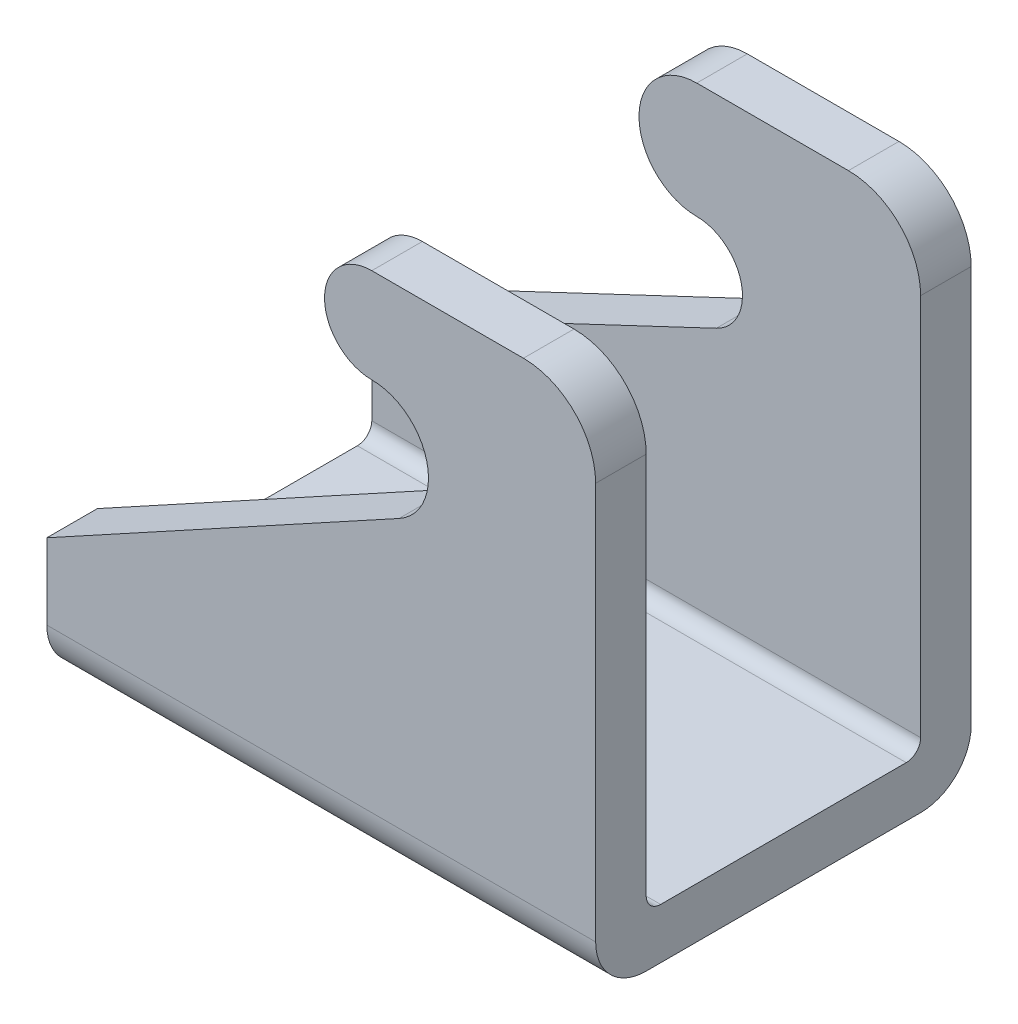
from build123d import *

# Parameters (mm, degrees)
SKETCH1_W           = 38
SKETCH1_H           = 36
BOSS_EXTRUDE1_DEPTH = 26
SKETCH2_W           = 19
SKETCH2_H           = 32.5
CUT_EXTRUDE1_DEPTH  = 54.935146241
CUT_EXTRUDE2_REACH  = 60.447
CUT_EXTRUDE3_REACH  = 60.447
FILLET1_R           = 1
FILLET2_R           = 3.5
FILLET3_R           = 5


with BuildPart() as part:
    # Sketch1 → Boss-Extrude1 (new body)
    with BuildSketch(Plane.XY.offset(13)):
        with Locations((19, 18)):
            Rectangle(SKETCH1_W, SKETCH1_H)
    extrude(amount=-BOSS_EXTRUDE1_DEPTH)

    # Sketch2 → Cut-Extrude1 (cut, through all)
    with BuildSketch(Plane(origin=(38, 0, 0), x_dir=(0, 0, -1), z_dir=(1, 0, 0))):
        with Locations((0, 19.75)):
            Rectangle(SKETCH2_W, SKETCH2_H)
    extrude(amount=-CUT_EXTRUDE1_DEPTH, mode=Mode.SUBTRACT)

    # Sketch3 → Cut-Extrude2 (cut, up to next)
    with BuildSketch(Plane.XY.offset(13), mode=Mode.PRIVATE) as cut_extrude2_sk1:
        with BuildLine():
            Line((22.5, 36), (0, 36))
            Line((0, 36), (0, 8.734288837))
            Line((0, 8.734288837), (24.385099457, 22.083618886))
            ThreePointArc((24.385099457, 22.083618886), (26.303250734, 26.500012997), (22.5, 29.45282947))
            ThreePointArc((22.5, 29.45282947), (19.226414735, 32.726414735), (22.5, 36))
        make_face()
    cut_extrude2_tool1 = extrude(cut_extrude2_sk1.sketch, amount=-CUT_EXTRUDE2_REACH, mode=Mode.PRIVATE) & part.part
    add(cut_extrude2_tool1.solids().sort_by_distance((10.485992, 24.898976, 13))[0], mode=Mode.SUBTRACT)

    # Sketch4 → Cut-Extrude3 (cut, up to next)
    with BuildSketch(Plane(origin=(0, 0, -13), x_dir=(-1, 0, 0), z_dir=(0, 0, -1)), mode=Mode.PRIVATE) as cut_extrude3_sk1:
        with BuildLine():
            Line((-23.85253982, 21.972620507), (0, 10.7))
            Line((0, 10.7), (0, 36))
            Line((0, 36), (-22.5, 36))
            ThreePointArc((-22.5, 36), (-18.5, 32), (-22.5, 28))
            ThreePointArc((-22.5, 28), (-25.588635116, 25.527643349), (-23.85253982, 21.972620507))
        make_face()
    cut_extrude3_tool1 = extrude(cut_extrude3_sk1.sketch, amount=-CUT_EXTRUDE3_REACH, mode=Mode.PRIVATE) & part.part
    add(cut_extrude3_tool1.solids().sort_by_distance((10.140401, 25.382196, -13))[0], mode=Mode.SUBTRACT)

    # Fillet1
    fillet1_edges = [part.edges().sort_by_distance(p)[0] for p in [
        (19, 3.5, -9.5),
        (19, 3.5, 9.5),
    ]]
    fillet(fillet1_edges, radius=FILLET1_R)

    # Fillet2
    fillet2_edges = [part.edges().sort_by_distance(p)[0] for p in [
        (19, 0, -13),
        (19, 0, 13),
    ]]
    fillet(fillet2_edges, radius=FILLET2_R)

    # Fillet3
    fillet3_edges = [part.edges().sort_by_distance(p)[0] for p in [
        (38, 36, 11.25),
        (38, 36, -11.25),
    ]]
    fillet(fillet3_edges, radius=FILLET3_R)


solid = part.part
